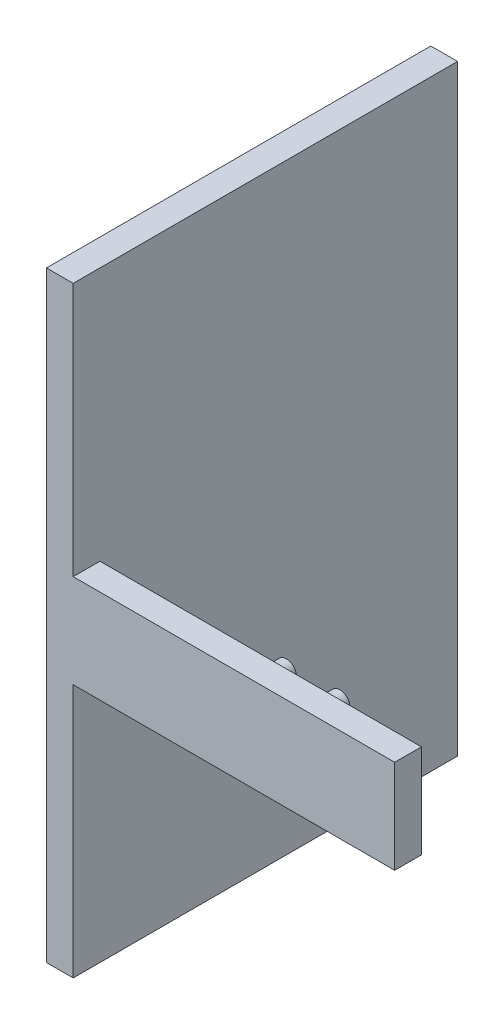
from build123d import *

# Parameters (mm, degrees)
SKETCH1_W           = 52.1
SKETCH1_H           = 14
BOSS_EXTRUDE1_DEPTH = 4
SKETCH2_W           = 57.5
SKETCH2_H           = 90
BOSS_EXTRUDE2_DEPTH = 4
SKETCH3_R           = 1.5
BOSS_EXTRUDE3_DEPTH = 2.8
SKETCH4_R           = 1.5
BOSS_EXTRUDE4_DEPTH = 2.8


with BuildPart() as part:
    # Sketch1 → Boss-Extrude1 (new body)
    with BuildSketch(Plane.XY.offset(18.5)):
        with Locations((-100.65, 0)):
            Rectangle(SKETCH1_W, SKETCH1_H)
    extrude(amount=BOSS_EXTRUDE1_DEPTH)

    # Sketch2 → Boss-Extrude2 (add)
    with BuildSketch(Plane(origin=(-126.7, 0, 0), x_dir=(0, 0, -1), z_dir=(1, 0, 0))):
        with Locations((6.25, 0)):
            Rectangle(SKETCH2_W, SKETCH2_H)
    extrude(amount=BOSS_EXTRUDE2_DEPTH)

    # Sketch3 → Boss-Extrude3 (add)
    with BuildSketch(Plane.XY.offset(15.7)):
        with Locations((-89.6, 4)):
            Circle(SKETCH3_R)
        with Locations((-89.6, -4)):
            Circle(SKETCH3_R)
        with Locations((-97.6, 4)):
            Circle(SKETCH3_R)
        with Locations((-97.6, -4)):
            Circle(SKETCH3_R)
    extrude(amount=BOSS_EXTRUDE3_DEPTH)

    # Sketch4 → Boss-Extrude4 (add)
    with BuildSketch(Plane(origin=(-129.5, 0, 0), x_dir=(0, 0, -1), z_dir=(1, 0, 0))):
        with Locations((15, -30)):
            Circle(SKETCH4_R)
        with Locations((-15, -30)):
            Circle(SKETCH4_R)
        with Locations((15, 30)):
            Circle(SKETCH4_R)
        with Locations((-15, 30)):
            Circle(SKETCH4_R)
    extrude(amount=BOSS_EXTRUDE4_DEPTH)


solid = part.part
